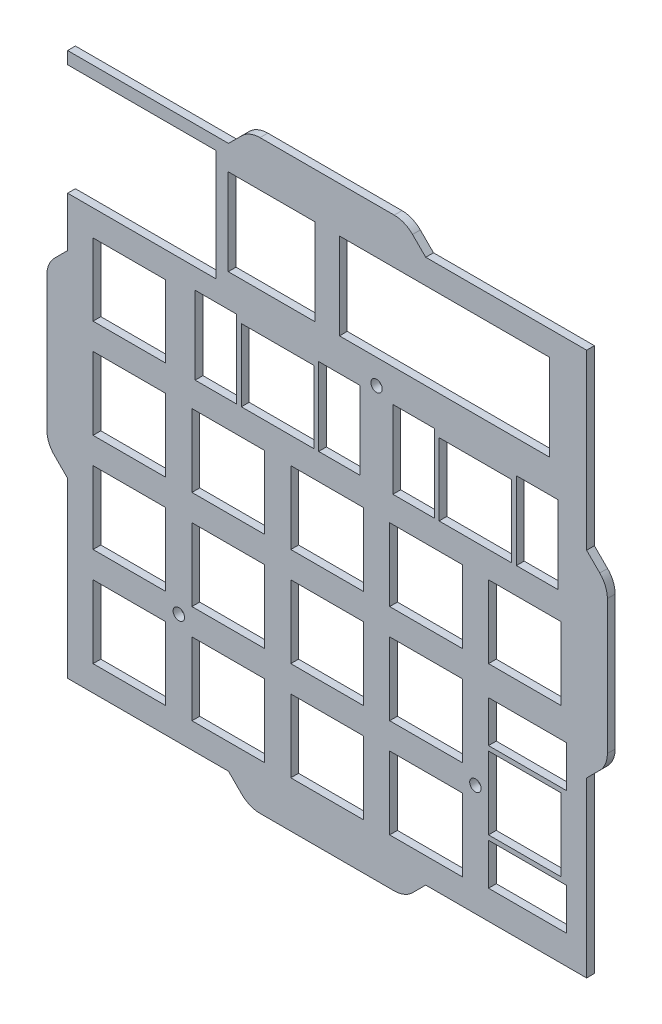
from build123d import *

# Parameters (mm, degrees)
SKETCH2_R           = 1.1
SKETCH2_W           = 14
SKETCH2_H           = 14
SKETCH2_W_2         = 13.999864793
SKETCH2_W_3         = 13.898443713
SKETCH2_W_4         = 14.000250013
SKETCH2_H_2         = 13.999122456
SKETCH2_H_3         = 13.99899745
SKETCH2_H_4         = 13.994084704
SKETCH2_W_5         = 16.66875
SKETCH2_H_5         = 16.66875
SKETCH2_H_6         = 40.48125
SKETCH2_W_6         = 8
SKETCH2_H_7         = 15
SKETCH2_W_7         = 15
SKETCH2_H_8         = 8
BOSS_EXTRUDE1_DEPTH = 1.5


with BuildPart() as part:
    # Sketch2 → Boss-Extrude1 (new body)
    with BuildSketch(Plane(origin=(0, 0, 0), x_dir=(0, 1, 0), z_dir=(0, 0, 1))):
        with BuildLine():
            Line((78.680047039, 95.509365468), (78.680047039, 69.315615468))
            Line((78.680047039, 69.315615468), (100.110297039, 69.315615468))
            Line((100.110297039, 69.315615468), (100.110297039, 95.563583947))
            Line((100.110297039, 95.563583947), (100.110297039, 97.890615468))
            Line((100.110297039, 97.890615468), (102.491547039, 97.890615468))
            Line((102.491547039, 97.890615468), (102.491547039, 95.509365468))
            Line((102.491547039, 95.509365468), (102.491547039, 66.884365468))
            Line((102.491547039, 66.884365468), (105.027080945, 64.348831562))
            ThreePointArc((105.027080945, 64.348831562), (106.110944702, 62.726714818), (106.491547039, 60.813297656))
            Line((106.491547039, 60.813297656), (106.491547039, 34.95543328))
            ThreePointArc((106.491547039, 34.95543328), (106.110944702, 33.042016118), (105.027080945, 31.419899374))
            Line((105.027080945, 31.419899374), (102.491547039, 28.884365468))
            Line((102.491547039, 28.884365468), (102.491547039, 0.259365468))
            Line((102.491547039, 0.259365468), (102.491547039, -2.121884532))
            Line((102.491547039, -2.121884532), (69.102852155, -2.121884532))
            Line((69.102852155, -2.121884532), (66.567318249, -4.657418438))
            ThreePointArc((66.567318249, -4.657418438), (64.945201505, -5.741282195), (63.031784343, -6.121884532))
            Line((63.031784343, -6.121884532), (37.173919967, -6.121884532))
            ThreePointArc((37.173919967, -6.121884532), (35.260502805, -5.741282195), (33.638386061, -4.657418438))
            Line((33.638386061, -4.657418438), (31.102852155, -2.121884532))
            Line((31.102852155, -2.121884532), (-2.285842729, -2.121884532))
            Line((-2.285842729, -2.121884532), (-2.285842729, 28.884365468))
            Line((-2.285842729, 28.884365468), (-4.821376635, 31.419899374))
            ThreePointArc((-4.821376635, 31.419899374), (-5.905240392, 33.042016118), (-6.285842729, 34.95543328))
            Line((-6.285842729, 34.95543328), (-6.285842729, 60.813297656))
            ThreePointArc((-6.285842729, 60.813297656), (-5.905240392, 62.726714818), (-4.821376635, 64.348831562))
            Line((-4.821376635, 64.348831562), (-2.285842729, 66.884365468))
            Line((-2.285842729, 66.884365468), (-2.285842729, 97.890615468))
            Line((-2.285842729, 97.890615468), (31.102852155, 97.890615468))
            Line((31.102852155, 97.890615468), (33.638386061, 100.426149374))
            ThreePointArc((33.638386061, 100.426149374), (35.260502805, 101.510013131), (37.173919967, 101.890615468))
            Line((37.173919967, 101.890615468), (63.031784343, 101.890615468))
            ThreePointArc((63.031784343, 101.890615468), (64.945201505, 101.510013131), (66.567318249, 100.426149374))
            Line((66.567318249, 100.426149374), (69.102852155, 97.890615468))
            Line((69.102852155, 97.890615468), (78.680047039, 97.890615468))
            Line((78.680047039, 97.890615468), (78.680047039, 95.509365468))
        make_face()
        with Locations(Location((19.145407271, 76.459365468, 0), (0, 0, 270))):
            Circle(SKETCH2_R, mode=Mode.SUBTRACT)
        with Locations(Location((19.145407271, 19.309365468, 0), (0, 0, 270))):
            Circle(SKETCH2_R, mode=Mode.SUBTRACT)
        with Locations(Location((76.298797039, 38.359365468, 0), (0, 0, 270))):
            Circle(SKETCH2_R, mode=Mode.SUBTRACT)
        with Locations((19.145407271, 9.783779189)):
            Rectangle(SKETCH2_W, SKETCH2_H, mode=Mode.SUBTRACT)
        with Locations((47.721668484, 9.783779189)):
            Rectangle(SKETCH2_W_2, SKETCH2_H, mode=Mode.SUBTRACT)
        with Locations((66.721910491, 19.309365468)):
            Rectangle(SKETCH2_W_3, SKETCH2_H, mode=Mode.SUBTRACT)
        with Locations((9.619905995, 28.834302965)):
            Rectangle(SKETCH2_W_4, SKETCH2_H_2, mode=Mode.SUBTRACT)
        with Locations((28.67078354, 28.834302965)):
            Rectangle(SKETCH2_W, SKETCH2_H_2, mode=Mode.SUBTRACT)
        with Locations((47.721668484, 28.834302965)):
            Rectangle(SKETCH2_W_2, SKETCH2_H_2, mode=Mode.SUBTRACT)
        with Locations((9.619905995, 47.884365468)):
            Rectangle(SKETCH2_W_4, SKETCH2_H_3, mode=Mode.SUBTRACT)
        with Locations((28.67078354, 47.884365468)):
            Rectangle(SKETCH2_W, SKETCH2_H_3, mode=Mode.SUBTRACT)
        with Locations((47.721668484, 47.884365468)):
            Rectangle(SKETCH2_W_2, SKETCH2_H_3, mode=Mode.SUBTRACT)
        with Locations((66.721910491, 57.409365468)):
            Rectangle(SKETCH2_W_3, SKETCH2_H, mode=Mode.SUBTRACT)
        with Locations((9.619905995, 66.933889194)):
            Rectangle(SKETCH2_W_4, SKETCH2_H_4, mode=Mode.SUBTRACT)
        with Locations((28.67078354, 66.933889194)):
            Rectangle(SKETCH2_W, SKETCH2_H_4, mode=Mode.SUBTRACT)
        with Locations((47.721668484, 66.933889194)):
            Rectangle(SKETCH2_W_2, SKETCH2_H_4, mode=Mode.SUBTRACT)
        with Locations((9.619905995, 85.98779939)):
            Rectangle(SKETCH2_W_4, SKETCH2_H, mode=Mode.SUBTRACT)
        with Locations((28.67078354, 85.98779939)):
            Rectangle(SKETCH2_W, SKETCH2_H, mode=Mode.SUBTRACT)
        with Locations((47.721668484, 85.98779939)):
            Rectangle(SKETCH2_W_2, SKETCH2_H, mode=Mode.SUBTRACT)
        with Locations((66.721910491, 85.98779939)):
            Rectangle(SKETCH2_W_3, SKETCH2_H, mode=Mode.SUBTRACT)
        with Locations((89.395672039, 58.599990468)):
            Rectangle(SKETCH2_W_5, SKETCH2_H_5, mode=Mode.SUBTRACT)
        with Locations((89.395672039, 25.262490468)):
            Rectangle(SKETCH2_W_5, SKETCH2_H_6, mode=Mode.SUBTRACT)
        with Locations((31.045407271, 9.283779189)):
            Rectangle(SKETCH2_W_6, SKETCH2_H_7, mode=Mode.SUBTRACT)
        with Locations((7.245407271, 9.283779189)):
            Rectangle(SKETCH2_W_6, SKETCH2_H_7, mode=Mode.SUBTRACT)
        with Locations((67.272688635, 31.209365468)):
            Rectangle(SKETCH2_W_7, SKETCH2_H_8, mode=Mode.SUBTRACT)
        with Locations((67.272688635, 7.409365468)):
            Rectangle(SKETCH2_W_7, SKETCH2_H_8, mode=Mode.SUBTRACT)
        with Locations((67.272688635, 45.509365468)):
            Rectangle(SKETCH2_W_7, SKETCH2_H_8, mode=Mode.SUBTRACT)
        with Locations((67.272688635, 69.309365468)):
            Rectangle(SKETCH2_W_7, SKETCH2_H_8, mode=Mode.SUBTRACT)
    extrude(amount=BOSS_EXTRUDE1_DEPTH)


solid = part.part
